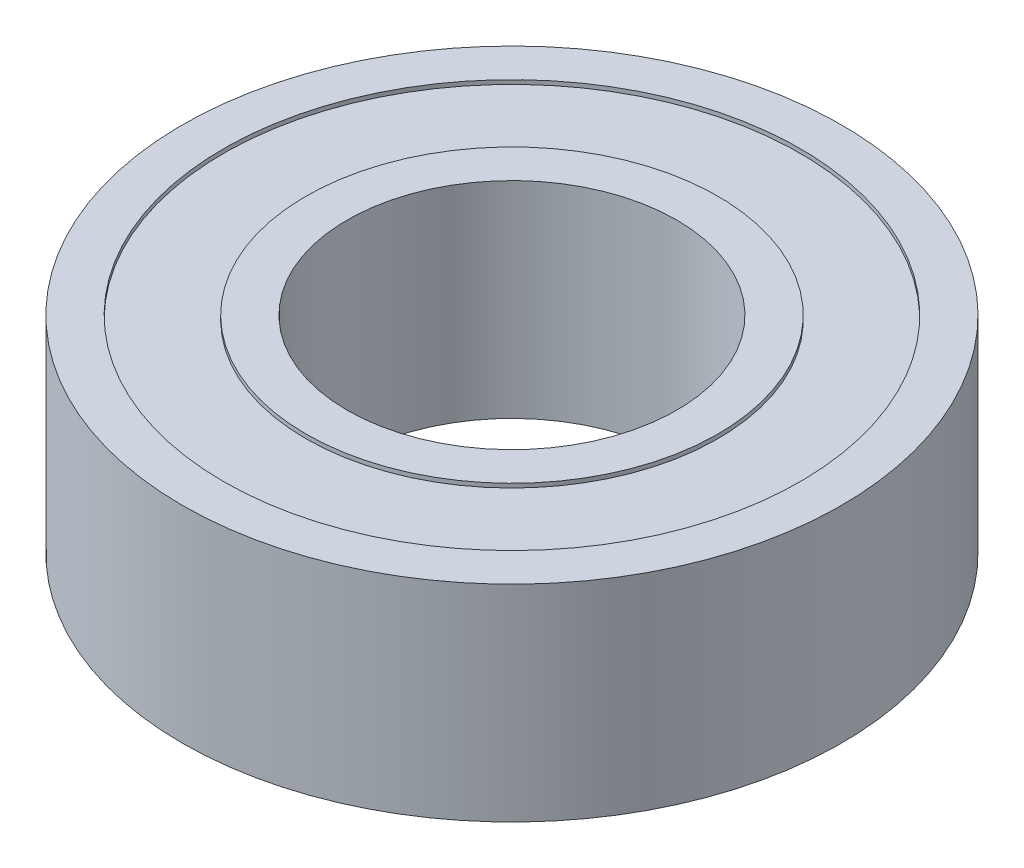
from build123d import *

# Parameters (mm, degrees)
SKETCH1_R      = 8
SKETCH1_R_2    = 4
EXTRUDE1_DEPTH = 5
SKETCH2_R      = 7
SKETCH2_R_2    = 5
EXTRUDE2_DEPTH = 0.1
EXTRUDE3_START = -0.1
SKETCH3_R      = 7
SKETCH3_R_2    = 5
EXTRUDE3_DEPTH = 0.1


with BuildPart() as part:
    # Sketch1 → Extrude1 (new body)
    with BuildSketch(Plane(origin=(0, 0, 0), x_dir=(1, 0, 0), z_dir=(0, 1, 0))):
        Circle(SKETCH1_R)
        Circle(SKETCH1_R_2, mode=Mode.SUBTRACT)
    extrude(amount=EXTRUDE1_DEPTH)

    # Sketch2 → Extrude2 (cut)
    with BuildSketch(Plane(origin=(0, 5, 0), x_dir=(1, 0, 0), z_dir=(0, 1, 0))):
        Circle(SKETCH2_R)
        Circle(SKETCH2_R_2, mode=Mode.SUBTRACT)
    extrude(amount=-EXTRUDE2_DEPTH, mode=Mode.SUBTRACT)

    # Sketch3 → Extrude3 (cut)
    with BuildSketch(Plane.XZ.offset(EXTRUDE3_START)):
        Circle(SKETCH3_R)
        Circle(SKETCH3_R_2, mode=Mode.SUBTRACT)
    extrude(amount=EXTRUDE3_DEPTH, mode=Mode.SUBTRACT)


solid = part.part
